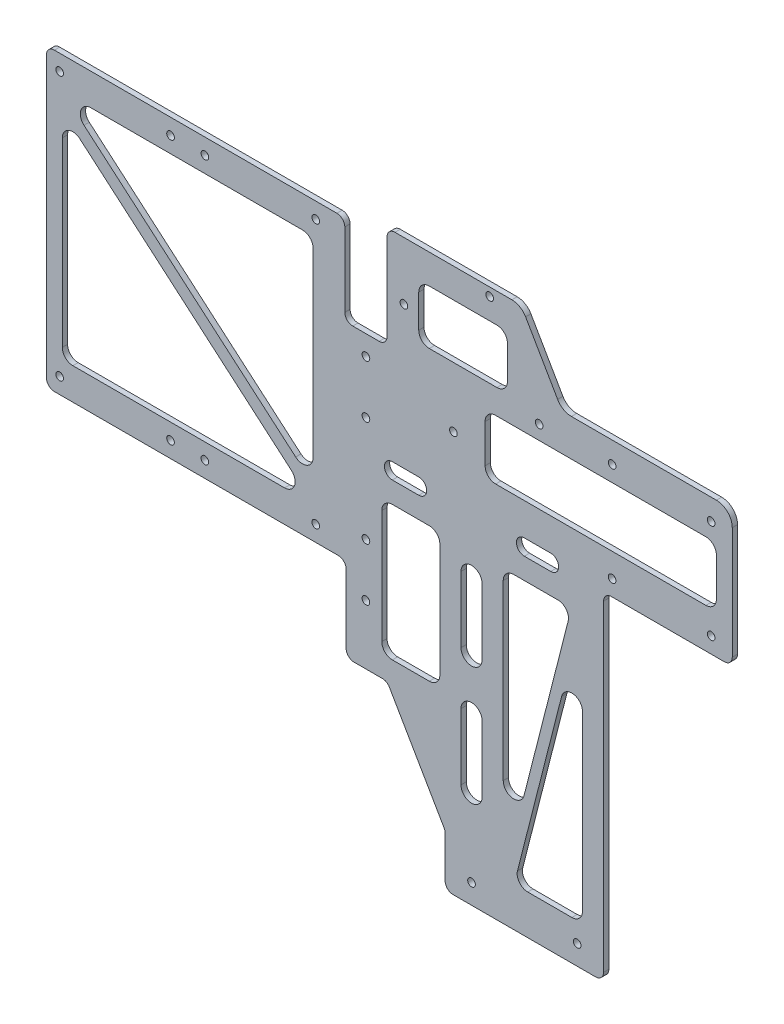
from build123d import *

# Parameters (mm, degrees)
SKETCH_1_R          = 1.45
EXTRUDE_1_DEPTH     = 2
FILLET_1_R          = 3
SKETCH_2_W          = 95
SKETCH_2_H          = 88
SKETCH_2_W_2        = 30
SKETCH_2_H_2        = 101.5
SKETCH_2_W_3        = 87.612976321
SKETCH_2_H_3        = 22.5
SKETCH_2_W_4        = 22
SKETCH_2_H_4        = 51
SKETCH_2_W_5        = 33.612976321
SKETCH_2_H_5        = 20.475952642
CUT_EXTRUDE_1_DEPTH = 10
EXTRUDE_2_DEPTH     = 2
FILLET_2_R          = 4
FILLET_3_R          = 6


with BuildPart() as part:
    # 草图1 → 凸台-拉伸1 (new body)
    with BuildSketch(Plane.XY):
        Polygon((-7.5, 50), (0, 50), (8, 50), (30, 12), (30, 0), (30, -7.5), (90, -7.5), (90, 120.25), (138.75, 120.25), (138.75, 198.75), (8, 198.75), (8, 160), (-8, 160), (-8, 194), (-121, 194), (-121, 82), (-7.5, 82), align=None)
        with Locations((0, 72.5)):
            Circle(SKETCH_1_R, mode=Mode.SUBTRACT)
        with Locations((0, 92.5)):
            Circle(SKETCH_1_R, mode=Mode.SUBTRACT)
        with Locations((0, 152.5)):
            Circle(SKETCH_1_R, mode=Mode.SUBTRACT)
        with Locations((40, 0)):
            Circle(SKETCH_1_R, mode=Mode.SUBTRACT)
        with Locations((80, 0)):
            Circle(SKETCH_1_R, mode=Mode.SUBTRACT)
        with Locations((0, 132.5)):
            Circle(SKETCH_1_R, mode=Mode.SUBTRACT)
        with Locations((-116, 188)):
            Circle(SKETCH_1_R, mode=Mode.SUBTRACT)
        with Locations((-74, 188)):
            Circle(SKETCH_1_R, mode=Mode.SUBTRACT)
        with Locations((-116, 88)):
            Circle(SKETCH_1_R, mode=Mode.SUBTRACT)
        with Locations((-74, 88)):
            Circle(SKETCH_1_R, mode=Mode.SUBTRACT)
        with Locations((-61, 88)):
            Circle(SKETCH_1_R, mode=Mode.SUBTRACT)
        with Locations((-19, 88)):
            Circle(SKETCH_1_R, mode=Mode.SUBTRACT)
        with Locations((-19, 188)):
            Circle(SKETCH_1_R, mode=Mode.SUBTRACT)
        with Locations((-61, 188)):
            Circle(SKETCH_1_R, mode=Mode.SUBTRACT)
        with Locations((14.387023679, 176.862976321)):
            Circle(SKETCH_1_R, mode=Mode.SUBTRACT)
        with Locations((46.862976321, 195.612976321)):
            Circle(SKETCH_1_R, mode=Mode.SUBTRACT)
        with Locations((65.612976321, 163.137023679)):
            Circle(SKETCH_1_R, mode=Mode.SUBTRACT)
        with Locations((33.137023679, 144.387023679)):
            Circle(SKETCH_1_R, mode=Mode.SUBTRACT)
        with Locations((93.25, 163.75)):
            Circle(SKETCH_1_R, mode=Mode.SUBTRACT)
        with Locations((130.75, 163.75)):
            Circle(SKETCH_1_R, mode=Mode.SUBTRACT)
        with Locations((130.75, 126.25)):
            Circle(SKETCH_1_R, mode=Mode.SUBTRACT)
        with Locations((93.25, 126.25)):
            Circle(SKETCH_1_R, mode=Mode.SUBTRACT)
        with BuildLine():
            Line((36, 30), (36, 55))
            ThreePointArc((36, 55), (40, 59), (44, 55))
            Line((44, 55), (44, 30))
            ThreePointArc((44, 30), (40, 26), (36, 30))
        make_face(mode=Mode.SUBTRACT)
        with BuildLine():
            Line((36, 75), (36, 100))
            ThreePointArc((36, 100), (40, 104), (44, 100))
            Line((44, 100), (44, 75))
            ThreePointArc((44, 75), (40, 71), (36, 75))
        make_face(mode=Mode.SUBTRACT)
        with BuildLine():
            Line((10, 123), (20, 123))
            ThreePointArc((20, 123), (23, 120), (20, 117))
            Line((20, 117), (10, 117))
            ThreePointArc((10, 117), (7, 120), (10, 123))
        make_face(mode=Mode.SUBTRACT)
        with BuildLine():
            Line((60, 123), (70, 123))
            ThreePointArc((70, 123), (73, 120), (70, 117))
            Line((70, 117), (60, 117))
            ThreePointArc((60, 117), (57, 120), (60, 123))
        make_face(mode=Mode.SUBTRACT)
    extrude(amount=EXTRUDE_1_DEPTH)

    # 圆角1
    fillet_1_edges = [part.edges().sort_by_distance(p)[0] for p in [
        (-7.5, 82, 1),
        (-121, 82, 1),
        (-121, 194, 1),
        (-8, 194, 1),
        (-8, 160, 1),
        (8, 160, 1),
        (8, 198.75, 1),
        (138.75, 198.75, 1),
        (138.75, 120.25, 1),
        (90, 120.25, 1),
        (90, -7.5, 1),
        (30, -7.5, 1),
        (30, 12, 1),
        (8, 50, 1),
        (-7.5, 50, 1),
    ]]
    fillet(fillet_1_edges, radius=FILLET_1_R)

    # 草图2 → 切除-拉伸1 (cut)
    with BuildSketch(Plane.XY.offset(2)):
        with Locations((-67.5, 138)):
            Rectangle(SKETCH_2_W, SKETCH_2_H)
        Polygon((58.75, 198.75), (74.338457268, 171.75), (138.75, 171.75), (138.75, 198.75), align=None)
        with Locations((67, 58.25)):
            Rectangle(SKETCH_2_W_2, SKETCH_2_H_2)
        with Locations((88.94351184, 146.5)):
            Rectangle(SKETCH_2_W_3, SKETCH_2_H_3)
        with Locations((17, 83.5)):
            Rectangle(SKETCH_2_W_4, SKETCH_2_H_4)
        with Locations((36.806488161, 177.375)):
            Rectangle(SKETCH_2_W_5, SKETCH_2_H_5)
    extrude(amount=-CUT_EXTRUDE_1_DEPTH, mode=Mode.SUBTRACT)

    # 草图3 → 凸台-拉伸2 (add)
    with BuildSketch(Plane.XY):
        Polygon((82, 109), (56.127900679, 7.5), (52, 7.5), (77.872099321, 109), align=None)
        Polygon((-20, 94), (-115, 175.415073416), (-115, 182), (-20, 100.584926584), align=None)
    extrude(amount=EXTRUDE_2_DEPTH)

    # 圆角2
    fillet_2_edges = [part.edges().sort_by_distance(p)[0] for p in [
        (-20, 182, 1),
        (-20, 94, 1),
        (-115, 94, 1),
        (-115, 182, 1),
        (53.612976321, 187.612976321, 1),
        (53.612976321, 167.137023679, 1),
        (20, 167.137023679, 1),
        (20, 187.612976321, 1),
        (82, 109, 1),
        (82, 7.5, 1),
        (52, 7.5, 1),
        (52, 109, 1),
        (132.75, 157.75, 1),
        (132.75, 135.25, 1),
        (45.137023679, 135.25, 1),
        (45.137023679, 157.75, 1),
        (28, 109, 1),
        (28, 58, 1),
        (6, 58, 1),
        (6, 109, 1),
        (77.872099321, 109, 1),
        (56.127900679, 7.5, 1),
        (-20, 100.584926584, 1),
        (-115, 175.415073416, 1),
    ]]
    fillet(fillet_2_edges, radius=FILLET_2_R)

    # 圆角3
    fillet_3_edges = [part.edges().sort_by_distance(p)[0] for p in [
        (138.75, 171.75, 1),
        (74.338457268, 171.75, 1),
        (58.75, 198.75, 1),
    ]]
    fillet(fillet_3_edges, radius=FILLET_3_R)


solid = part.part
